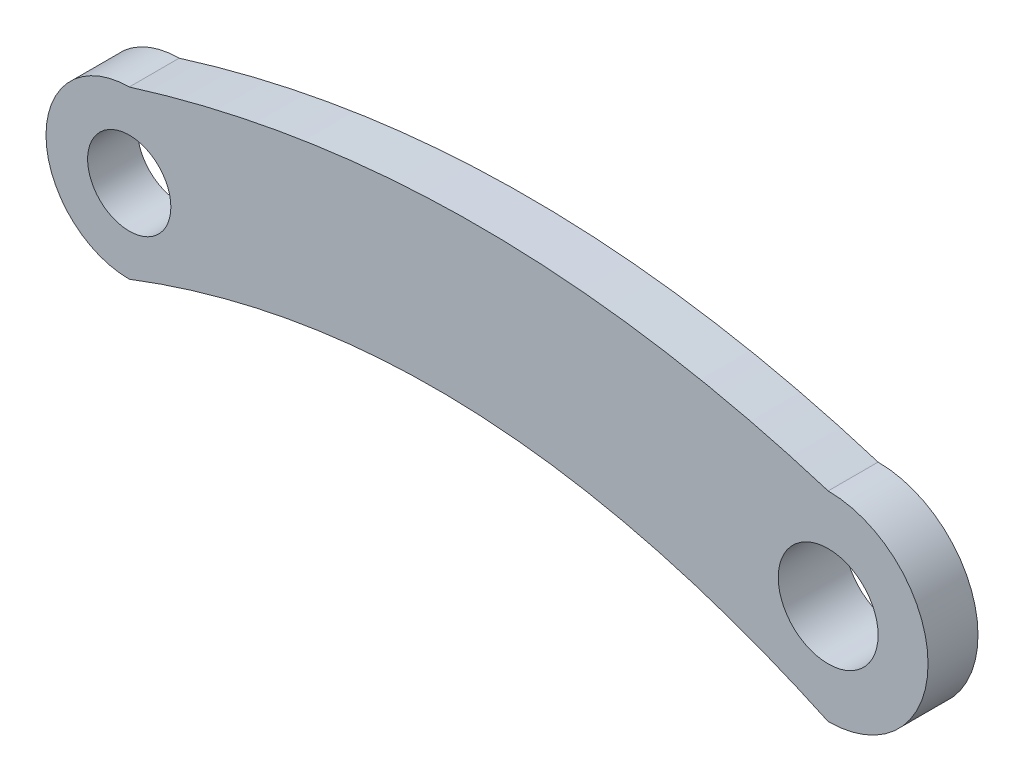
from build123d import *
from build123d.topology import SkipClean

# Parameters (mm, degrees)
BOSS_EXTRUDE1_DEPTH = 30
SKETCH2_R           = 25
SKETCH2_R_2         = 30
CUT_EXTRUDE1_DEPTH  = 527.798524366
BOSS_EXTRUDE2_START = 10
SKETCH3_R           = 40
SKETCH3_R_2         = 30
BOSS_EXTRUDE2_DEPTH = 10
SCALE1_SCALE        = 0.1


with BuildPart() as part:
    # Sketch1 → Boss-Extrude1 (new body)
    with BuildSketch(Plane.XY):
        with BuildLine():
            add(Edge.make_bspline(
                [(-267.733324074, 386.480114093), (-58.376892778, 451.86591416), (152.142574227, 386.270803333)],
                knots=[0, 0, 0, 1, 1, 1], degree=2))
            ThreePointArc((-267.733324074, 386.480114093), (-317.733324074, 336.480114093), (-267.733324074, 286.480114093))
            add(Edge.make_bspline(
                [(-267.733324074, 286.480114093), (-61.536299878, 365.758634067), (152.142574227, 266.270803333)],
                knots=[0, 0, 0, 1, 1, 1], degree=2))
            ThreePointArc((152.142574227, 266.270803333), (212.142574227, 326.270803333), (152.142574227, 386.270803333))
        make_face()
    extrude(amount=BOSS_EXTRUDE1_DEPTH)

    # Sketch2 → Cut-Extrude1 (cut, through all)
    with BuildSketch(Plane.XY):
        with Locations((-267.733324074, 336.480114093)):
            Circle(SKETCH2_R)
        with Locations((152.142574227, 326.270803333)):
            Circle(SKETCH2_R_2)
    extrude(amount=CUT_EXTRUDE1_DEPTH, mode=Mode.SUBTRACT)

    # Sketch3 → Boss-Extrude2 (add)
    with SkipClean():  # the faces are left unmerged after this step: merging them gives an invalid solid
        with BuildSketch(Plane(origin=(0, 0, 0), x_dir=(-1, 0, 0), z_dir=(0, 0, -1)).offset(BOSS_EXTRUDE2_START)):
            with Locations((-152.142574227, 326.270803333)):
                Circle(SKETCH3_R)
            with Locations((-152.142574227, 326.270803333)):
                Circle(SKETCH3_R_2, mode=Mode.SUBTRACT)
        extrude(amount=-BOSS_EXTRUDE2_DEPTH)


with BuildPart() as part_1:
    # Scale1: scaled about (-43.370651933, 353.535569424, 14.697038308)
    add(part.part.scale(SCALE1_SCALE).moved(Location((-39.03358674, 318.182012482, 13.227334477))))


solid = part_1.part
